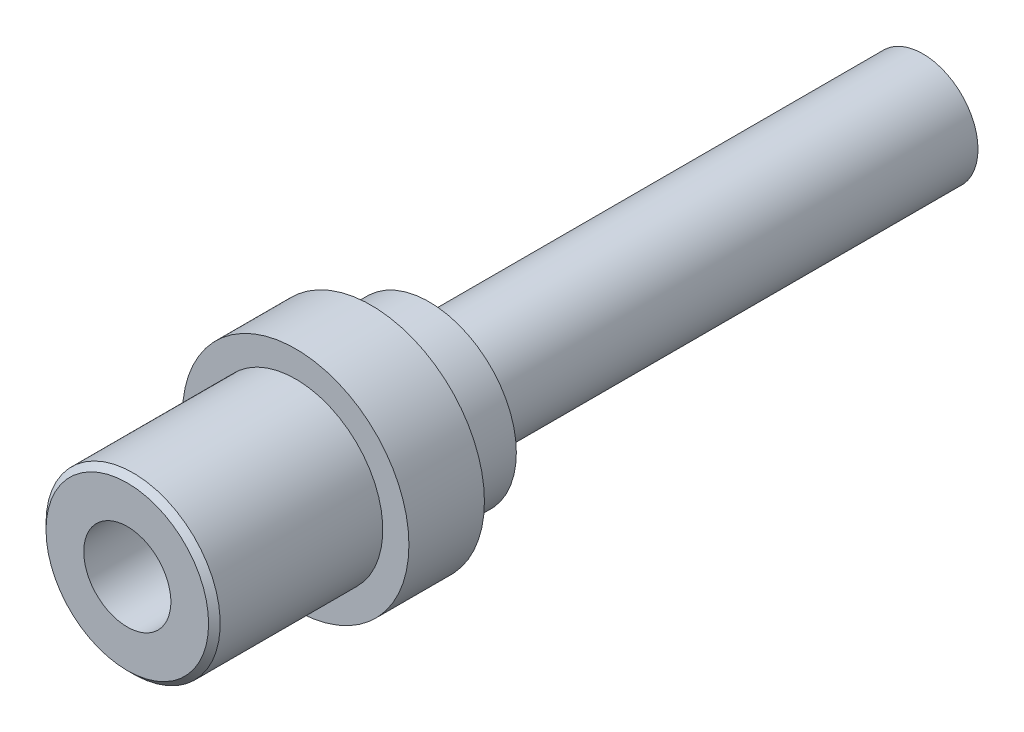
from build123d import *

# Parameters (mm, degrees)
SKETCH_1_R          = 9.5
EXTRUDE_1_DEPTH     = 85
SKETCH_2_R          = 15
EXTRUDE_2_DEPTH     = 10
SKETCH_3_R          = 19.5
EXTRUDE_3_DEPTH     = 13
SKETCH_4_R          = 15
EXTRUDE_4_DEPTH     = 29
CHAMFER_1_SIZE      = 1
SKETCH_5_R          = 7.5
CUT_EXTRUDE_1_DEPTH = 140.747987463


with BuildPart() as part:
    # Эскиз1 → Бобышка-Вытянуть1 (new body)
    with BuildSketch(Plane.XY):
        Circle(SKETCH_1_R)
    extrude(amount=EXTRUDE_1_DEPTH)

    # Эскиз2 → Бобышка-Вытянуть2 (add)
    with BuildSketch(Plane.XY.offset(85)):
        Circle(SKETCH_2_R)
    extrude(amount=EXTRUDE_2_DEPTH)

    # Эскиз3 → Бобышка-Вытянуть3 (add)
    with BuildSketch(Plane.XY.offset(95)):
        with Locations(Location((0, 0, 0), (0, 0, 180))):
            Circle(SKETCH_3_R)
    extrude(amount=EXTRUDE_3_DEPTH)

    # Эскиз4 → Бобышка-Вытянуть4 (add)
    with BuildSketch(Plane.XY.offset(108)):
        Circle(SKETCH_4_R)
    extrude(amount=EXTRUDE_4_DEPTH)

    # Фаска1
    chamfer_1_edges = [part.edges().sort_by_distance(p)[0] for p in [
        (-15, 0, 137),
    ]]
    chamfer(chamfer_1_edges, length=CHAMFER_1_SIZE)

    # Эскиз5 → Вырез-Вытянуть1 (cut, through all)
    with BuildSketch(Plane(origin=(0, 0, 0), x_dir=(-1, 0, 0), z_dir=(0, 0, -1))):
        Circle(SKETCH_5_R)
    extrude(amount=-CUT_EXTRUDE_1_DEPTH, mode=Mode.SUBTRACT)


solid = part.part
